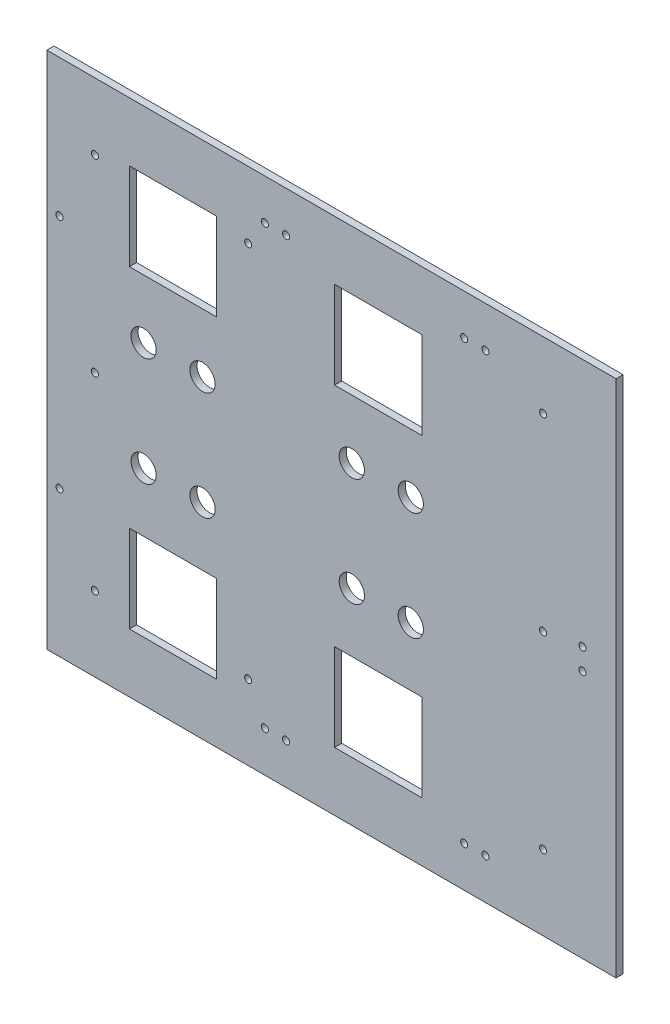
from build123d import *

# Parameters (mm, degrees)
SKETCH1_W           = 241.3
SKETCH1_H           = 210
BOSS_EXTRUDE1_DEPTH = 3
SKETCH2_W           = 37
SKETCH2_H           = 37
CUT_EXTRUDE1_DEPTH  = 3
SKETCH3_R           = 5.35
CUT_EXTRUDE2_DEPTH  = 3
CUT_EXTRUDE3_DEPTH  = 3
SKETCH9_W           = 241.3
SKETCH9_H           = 3
BOSS_EXTRUDE2_DEPTH = 5
SKETCH10_W          = 241.3
SKETCH10_H          = 3
BOSS_EXTRUDE3_DEPTH = 5
SKETCH11_R          = 1.5
CUT_EXTRUDE4_DEPTH  = 5
SKETCH12_R          = 1.5
CUT_EXTRUDE5_DEPTH  = 10
SKETCH13_R          = 1.5
CUT_EXTRUDE6_DEPTH  = 10


with BuildPart() as part:
    # Sketch1 → Boss-Extrude1 (new body)
    with BuildSketch(Plane.XY):
        with Locations((55.945744681, 20.177304965)):
            Rectangle(SKETCH1_W, SKETCH1_H)
    extrude(amount=BOSS_EXTRUDE1_DEPTH)

    # Sketch2 → Cut-Extrude1 (cut)
    with BuildSketch(Plane.XY.offset(3)):
        with Locations((-11.204255319, -46.322695035)):
            Rectangle(SKETCH2_W, SKETCH2_H)
        with Locations((75.795744681, -46.322695035)):
            Rectangle(SKETCH2_W, SKETCH2_H)
        with Locations((75.795744681, 86.677304965)):
            Rectangle(SKETCH2_W, SKETCH2_H)
        with Locations((-11.204255319, 86.677304965)):
            Rectangle(SKETCH2_W, SKETCH2_H)
    extrude(amount=-CUT_EXTRUDE1_DEPTH, mode=Mode.SUBTRACT)

    # Sketch3 → Cut-Extrude2 (cut)
    with BuildSketch(Plane.XY.offset(3)):
        with Locations((-23.704255319, -2.822695035)):
            Circle(SKETCH3_R)
        with Locations((1.295744681, -2.822695035)):
            Circle(SKETCH3_R)
        with Locations(Location((-23.704255319, 43.177304965, 0), (0, 0, 180))):
            Circle(SKETCH3_R)
        with Locations((1.295744681, 43.177304965)):
            Circle(SKETCH3_R)
        with Locations(Location((64.565894544, 43.177304965, 0), (0, 0, 180))):
            Circle(SKETCH3_R)
        with Locations((89.565894544, 43.177304965)):
            Circle(SKETCH3_R)
        with Locations(Location((89.565894544, -2.822695035, 0), (0, 0, 180))):
            Circle(SKETCH3_R)
        with Locations((64.565894544, -2.822695035)):
            Circle(SKETCH3_R)
    extrude(amount=-CUT_EXTRUDE2_DEPTH, mode=Mode.SUBTRACT)

    # Sketch6 → Cut-Extrude3 (cut)
    with BuildSketch(Plane.XY.offset(3)):
        with BuildLine():
            ThreePointArc((-42.852430173, 101.913921459), (-45.413090345, 102.974581631), (-44.352430173, 100.413921459))
            Line((-44.352430173, 100.413921459), (-44.352430173, 101.913921459))
            Line((-44.352430173, 101.913921459), (-42.852430173, 101.913921459))
        make_face()
        with BuildLine():
            Line((-44.352430173, 101.913921459), (-44.352430173, 100.413921459))
            ThreePointArc((-44.352430173, 100.413921459), (-43.291770002, 100.853261287), (-42.852430173, 101.913921459))
            Line((-42.852430173, 101.913921459), (-44.352430173, 101.913921459))
        make_face()
        with BuildLine():
            ThreePointArc((-42.852430173, 101.913921459), (-45.413090345, 102.974581631), (-44.352430173, 100.413921459))
            Line((-44.352430173, 100.413921459), (-44.352430173, 101.913921459))
            Line((-44.352430173, 101.913921459), (-42.852430173, 101.913921459))
        make_face()
        with BuildLine():
            Line((-44.352430173, 101.913921459), (-44.352430173, 100.413921459))
            ThreePointArc((-44.352430173, 100.413921459), (-43.291770002, 100.853261287), (-42.852430173, 101.913921459))
            Line((-42.852430173, 101.913921459), (-44.352430173, 101.913921459))
        make_face()
        with BuildLine():
            ThreePointArc((22.147569827, 101.913921459), (20.647569827, 103.413921459), (19.147569827, 101.913921459))
            Line((19.147569827, 101.913921459), (22.147569827, 101.913921459))
        make_face()
        with BuildLine():
            Line((22.147569827, 101.913921459), (19.147569827, 101.913921459))
            ThreePointArc((19.147569827, 101.913921459), (20.647569827, 100.413921459), (22.147569827, 101.913921459))
        make_face()
        with BuildLine():
            ThreePointArc((22.147569827, 101.913921459), (20.647569827, 103.413921459), (19.147569827, 101.913921459))
            Line((19.147569827, 101.913921459), (22.147569827, 101.913921459))
        make_face()
        with BuildLine():
            Line((22.147569827, 101.913921459), (19.147569827, 101.913921459))
            ThreePointArc((19.147569827, 101.913921459), (20.647569827, 100.413921459), (22.147569827, 101.913921459))
        make_face()
        with BuildLine():
            ThreePointArc((144.147569827, 101.913921459), (144.586909655, 100.853261287), (145.647569827, 100.413921459))
            Line((145.647569827, 100.413921459), (145.647569827, 101.913921459))
            Line((145.647569827, 101.913921459), (144.147569827, 101.913921459))
        make_face()
        with BuildLine():
            Line((145.647569827, 101.913921459), (145.647569827, 100.413921459))
            ThreePointArc((145.647569827, 100.413921459), (146.708229998, 100.853261287), (147.147569827, 101.913921459))
            ThreePointArc((147.147569827, 101.913921459), (145.647569827, 103.413921459), (144.147569827, 101.913921459))
            Line((144.147569827, 101.913921459), (145.647569827, 101.913921459))
        make_face()
        with BuildLine():
            ThreePointArc((144.147569827, 101.913921459), (144.586909655, 100.853261287), (145.647569827, 100.413921459))
            Line((145.647569827, 100.413921459), (145.647569827, 101.913921459))
            Line((145.647569827, 101.913921459), (144.147569827, 101.913921459))
        make_face()
        with BuildLine():
            Line((145.647569827, 101.913921459), (145.647569827, 100.413921459))
            ThreePointArc((145.647569827, 100.413921459), (146.708229998, 100.853261287), (147.147569827, 101.913921459))
            ThreePointArc((147.147569827, 101.913921459), (145.647569827, 103.413921459), (144.147569827, 101.913921459))
            Line((144.147569827, 101.913921459), (145.647569827, 101.913921459))
        make_face()
        with BuildLine():
            ThreePointArc((145.647569827, 23.413921459), (144.147569827, 21.913921459), (145.647569827, 20.413921459))
            Line((145.647569827, 20.413921459), (145.647569827, 23.413921459))
        make_face()
        with BuildLine():
            Line((145.647569827, 23.413921459), (145.647569827, 20.413921459))
            ThreePointArc((145.647569827, 20.413921459), (146.708229998, 20.853261287), (147.147569827, 21.913921459))
            ThreePointArc((147.147569827, 21.913921459), (146.708229998, 22.974581631), (145.647569827, 23.413921459))
        make_face()
        with BuildLine():
            ThreePointArc((145.647569827, 23.413921459), (144.147569827, 21.913921459), (145.647569827, 20.413921459))
            Line((145.647569827, 20.413921459), (145.647569827, 23.413921459))
        make_face()
        with BuildLine():
            Line((145.647569827, 23.413921459), (145.647569827, 20.413921459))
            ThreePointArc((145.647569827, 20.413921459), (146.708229998, 20.853261287), (147.147569827, 21.913921459))
            ThreePointArc((147.147569827, 21.913921459), (146.708229998, 22.974581631), (145.647569827, 23.413921459))
        make_face()
        with BuildLine():
            ThreePointArc((145.647569827, -56.586078541), (144.586909655, -57.025418369), (144.147569827, -58.086078541))
            Line((144.147569827, -58.086078541), (145.647569827, -58.086078541))
            Line((145.647569827, -58.086078541), (145.647569827, -56.586078541))
        make_face()
        with BuildLine():
            Line((145.647569827, -58.086078541), (144.147569827, -58.086078541))
            ThreePointArc((144.147569827, -58.086078541), (145.647569827, -59.586078541), (147.147569827, -58.086078541))
            ThreePointArc((147.147569827, -58.086078541), (146.708229998, -57.025418369), (145.647569827, -56.586078541))
            Line((145.647569827, -56.586078541), (145.647569827, -58.086078541))
        make_face()
        with BuildLine():
            ThreePointArc((145.647569827, -56.586078541), (144.586909655, -57.025418369), (144.147569827, -58.086078541))
            Line((144.147569827, -58.086078541), (145.647569827, -58.086078541))
            Line((145.647569827, -58.086078541), (145.647569827, -56.586078541))
        make_face()
        with BuildLine():
            Line((145.647569827, -58.086078541), (144.147569827, -58.086078541))
            ThreePointArc((144.147569827, -58.086078541), (145.647569827, -59.586078541), (147.147569827, -58.086078541))
            ThreePointArc((147.147569827, -58.086078541), (146.708229998, -57.025418369), (145.647569827, -56.586078541))
            Line((145.647569827, -56.586078541), (145.647569827, -58.086078541))
        make_face()
        with BuildLine():
            ThreePointArc((22.147569827, -58.086078541), (20.647569827, -56.586078541), (19.147569827, -58.086078541))
            Line((19.147569827, -58.086078541), (22.147569827, -58.086078541))
        make_face()
        with BuildLine():
            Line((22.147569827, -58.086078541), (19.147569827, -58.086078541))
            ThreePointArc((19.147569827, -58.086078541), (20.647569827, -59.586078541), (22.147569827, -58.086078541))
        make_face()
        with BuildLine():
            ThreePointArc((22.147569827, -58.086078541), (20.647569827, -56.586078541), (19.147569827, -58.086078541))
            Line((19.147569827, -58.086078541), (22.147569827, -58.086078541))
        make_face()
        with BuildLine():
            Line((22.147569827, -58.086078541), (19.147569827, -58.086078541))
            ThreePointArc((19.147569827, -58.086078541), (20.647569827, -59.586078541), (22.147569827, -58.086078541))
        make_face()
        with BuildLine():
            Line((-44.352430173, -56.586078541), (-44.352430173, -58.086078541))
            Line((-44.352430173, -58.086078541), (-42.852430173, -58.086078541))
            ThreePointArc((-42.852430173, -58.086078541), (-43.291770002, -57.025418369), (-44.352430173, -56.586078541))
        make_face()
        with BuildLine():
            Line((-42.852430173, -58.086078541), (-44.352430173, -58.086078541))
            Line((-44.352430173, -58.086078541), (-44.352430173, -56.586078541))
            ThreePointArc((-44.352430173, -56.586078541), (-45.413090345, -59.146738713), (-42.852430173, -58.086078541))
        make_face()
        with BuildLine():
            Line((-44.352430173, -56.586078541), (-44.352430173, -58.086078541))
            Line((-44.352430173, -58.086078541), (-42.852430173, -58.086078541))
            ThreePointArc((-42.852430173, -58.086078541), (-43.291770002, -57.025418369), (-44.352430173, -56.586078541))
        make_face()
        with BuildLine():
            Line((-42.852430173, -58.086078541), (-44.352430173, -58.086078541))
            Line((-44.352430173, -58.086078541), (-44.352430173, -56.586078541))
            ThreePointArc((-44.352430173, -56.586078541), (-45.413090345, -59.146738713), (-42.852430173, -58.086078541))
        make_face()
        with BuildLine():
            ThreePointArc((-44.352430173, 23.413921459), (-45.852430173, 21.913921459), (-44.352430173, 20.413921459))
            Line((-44.352430173, 20.413921459), (-44.352430173, 23.413921459))
        make_face()
        with BuildLine():
            Line((-44.352430173, 23.413921459), (-44.352430173, 20.413921459))
            ThreePointArc((-44.352430173, 20.413921459), (-43.291770002, 20.853261287), (-42.852430173, 21.913921459))
            ThreePointArc((-42.852430173, 21.913921459), (-43.291770002, 22.974581631), (-44.352430173, 23.413921459))
        make_face()
        with BuildLine():
            ThreePointArc((-44.352430173, 23.413921459), (-45.852430173, 21.913921459), (-44.352430173, 20.413921459))
            Line((-44.352430173, 20.413921459), (-44.352430173, 23.413921459))
        make_face()
        with BuildLine():
            Line((-44.352430173, 23.413921459), (-44.352430173, 20.413921459))
            ThreePointArc((-44.352430173, 20.413921459), (-43.291770002, 20.853261287), (-42.852430173, 21.913921459))
            ThreePointArc((-42.852430173, 21.913921459), (-43.291770002, 22.974581631), (-44.352430173, 23.413921459))
        make_face()
    extrude(amount=-CUT_EXTRUDE3_DEPTH, mode=Mode.SUBTRACT)

    # Sketch9 → Boss-Extrude2 (add)
    with BuildSketch(Plane(origin=(0, 125.177304965, 0), x_dir=(1, 0, 0), z_dir=(0, 1, 0))):
        with Locations((55.945744681, -1.5)):
            Rectangle(SKETCH9_W, SKETCH9_H)
    extrude(amount=BOSS_EXTRUDE2_DEPTH)

    # Sketch10 → Boss-Extrude3 (add)
    with BuildSketch(Plane.XZ.offset(84.822695035)):
        with Locations((55.945744681, 1.5)):
            Rectangle(SKETCH10_W, SKETCH10_H)
    extrude(amount=BOSS_EXTRUDE3_DEPTH)

    # Sketch11 → Cut-Extrude4 (cut)
    with BuildSketch(Plane.XY.offset(3)):
        with Locations((27.701352581, 112.924353788)):
            Circle(SKETCH11_R)
        with Locations((36.701352581, 112.924353788)):
            Circle(SKETCH11_R)
        with Locations((112.213569446, 112.924353788)):
            Circle(SKETCH11_R)
        with Locations((121.213569446, 112.924353788)):
            Circle(SKETCH11_R)
        with Locations((121.213569446, -72.569743859)):
            Circle(SKETCH11_R)
        with Locations((112.213569446, -72.569743859)):
            Circle(SKETCH11_R)
        with Locations((36.701352581, -72.569743859)):
            Circle(SKETCH11_R)
        with Locations((27.701352581, -72.569743859)):
            Circle(SKETCH11_R)
    extrude(amount=-CUT_EXTRUDE4_DEPTH, mode=Mode.SUBTRACT)

    # Sketch12 → Cut-Extrude5 (cut)
    with BuildSketch(Plane.XY.offset(3)):
        with Locations((162.341941635, 24.677304965)):
            Circle(SKETCH12_R)
        with Locations((162.341941635, 15.677304965)):
            Circle(SKETCH12_R)
    extrude(amount=-CUT_EXTRUDE5_DEPTH, mode=Mode.SUBTRACT)

    # Sketch13 → Cut-Extrude6 (cut)
    with BuildSketch(Plane(origin=(0, 0, 0), x_dir=(-1, 0, 0), z_dir=(0, 0, -1))):
        with Locations((59.352430173, 71.913921459)):
            Circle(SKETCH13_R)
        with Locations((59.352430173, -28.086078541)):
            Circle(SKETCH13_R)
    extrude(amount=-CUT_EXTRUDE6_DEPTH, mode=Mode.SUBTRACT)


solid = part.part
